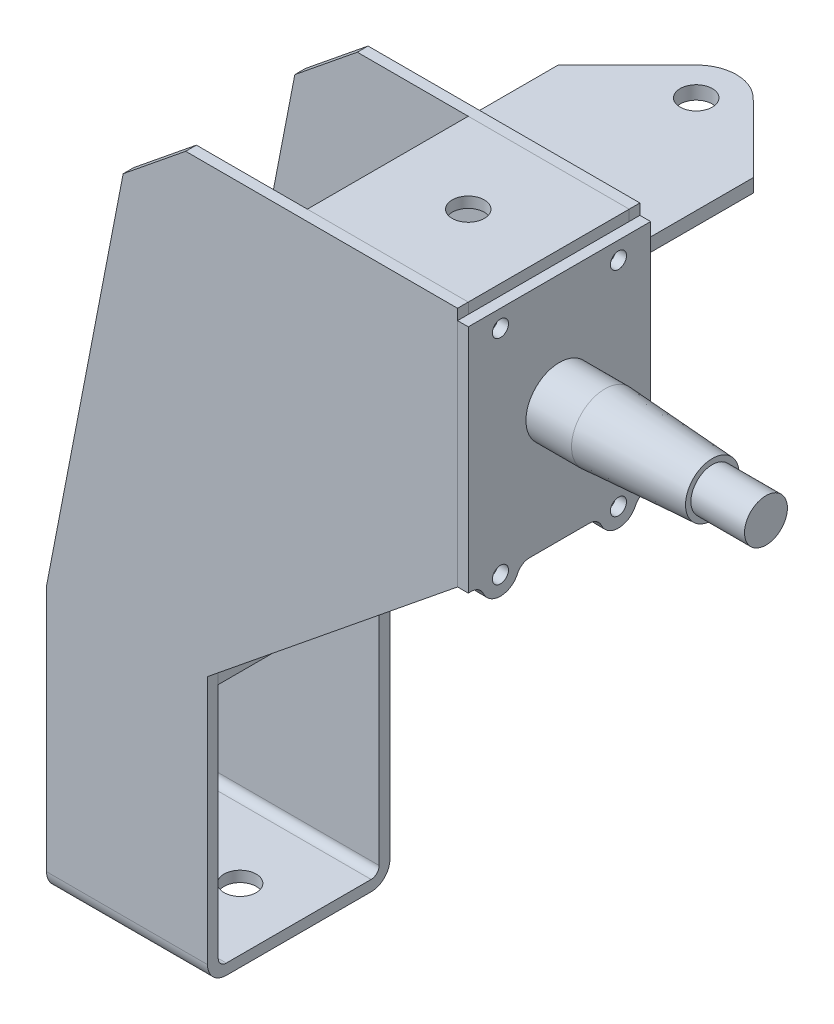
from build123d import *

# Parameters (mm, degrees)
BOSS_EXTRUDE2_DEPTH  = 107
CUT_EXTRUDE1_DEPTH   = 214
SKETCH5_W            = 60
SKETCH5_H            = 4
BOSS_EXTRUDE3_DEPTH  = 60
SKETCH6_W            = 60
SKETCH6_H            = 4
BOSS_EXTRUDE4_DEPTH  = 60
SKETCH7_R            = 3
BOSS_EXTRUDE5_DEPTH  = 4
SKETCH8_W            = 72.723840611
SKETCH8_H            = 5
BOSS_EXTRUDE6_DEPTH  = 100
CHAMFER1_SIZE        = 25
CHAMFER2_SIZE        = 25
SKETCH9_R            = 15
BOSS_EXTRUDE7_DEPTH  = 5
SKETCH10_R           = 12.25
CUT_EXTRUDE2_DEPTH   = 4
CUT_EXTRUDE5_DEPTH   = 8
SKETCH13_R           = 6
CUT_EXTRUDE6_DEPTH   = 10
SKETCH15_R           = 15
BOSS_EXTRUDE8_DEPTH  = 10
SKETCH16_R           = 12.25
BOSS_EXTRUDE9_DEPTH  = 10
SKETCH17_R           = 12.5
BOSS_EXTRUDE10_DEPTH = 77
SKETCH18_R           = 12.5
SKETCH18_R_2         = 8
CUT_EXTRUDE7_DEPTH   = 20
CHAMFER3_SIZE        = 40
CHAMFER3_SIZE2       = 2.5
SKETCH19_R           = 6
CUT_EXTRUDE8_DEPTH   = 20


with BuildPart() as part:
    # Sketch3 → Boss-Extrude2 (new, symmetric)
    with BuildSketch(Plane(origin=(0, 0, 0), x_dir=(0, 0, -1), z_dir=(1, 0, 0))):
        with BuildLine():
            Line((93.112387021, -93), (93.112387021, 165.555555556))
            Line((93.112387021, 165.555555556), (89.112387021, 165.555555556))
            Line((89.112387021, 165.555555556), (89.112387021, -93))
            ThreePointArc((89.112387021, -93), (88.233707365, -95.121320344), (86.112387021, -96))
            Line((86.112387021, -96), (32.112387021, -96))
            ThreePointArc((32.112387021, -96), (29.991066678, -95.121320344), (29.112387021, -93))
            Line((29.112387021, -93), (29.112387021, 165.555555556))
            Line((29.112387021, 165.555555556), (25.112387021, 165.555555556))
            Line((25.112387021, 165.555555556), (25.112387021, -93))
            ThreePointArc((25.112387021, -93), (27.162639553, -97.949747468), (32.112387021, -100))
            Line((32.112387021, -100), (86.112387021, -100))
            ThreePointArc((86.112387021, -100), (91.06213449, -97.949747468), (93.112387021, -93))
        make_face()
    extrude(amount=BOSS_EXTRUDE2_DEPTH, both=True)

    # Sketch4 → Cut-Extrude1 (cut)
    with BuildSketch(Plane.XY):
        Polygon((-190, 11.896699378), (-190, -230), (130, -230), (130, -61.975068301), (223.227453171, 13.580487255), (223.227453171, 295.555555556), (-54.204269584, 295.555555556), (-150.061773181, 217.868493514), align=None)
        Polygon((-60, -0.59060332), (-60, -100), (0, -100), (0, 0), (93.227453171, 75.555555556), (93.227453171, 165.555555556), (-8.139740481, 165.555555556), (-31.446603774, 146.666666667), align=None, mode=Mode.SUBTRACT)
    extrude(amount=-CUT_EXTRUDE1_DEPTH, mode=Mode.SUBTRACT)

    # Sketch13 → Cut-Extrude6 (cut)
    with BuildSketch(Plane.XZ.offset(100)):
        with Locations(Location((-23.160596036, -60.439663785, 0), (0, 0, 270))):
            Circle(SKETCH13_R)
    extrude(amount=-CUT_EXTRUDE6_DEPTH, mode=Mode.SUBTRACT)


with BuildPart() as body_2:
    # Sketch5 → Boss-Extrude3 (new body)
    with BuildSketch(Plane(origin=(0, 0, 0), x_dir=(0, 0, -1), z_dir=(1, 0, 0))):
        with Locations((59.112387021, -2.59060332)):
            Rectangle(SKETCH5_W, SKETCH5_H)
    extrude(amount=-BOSS_EXTRUDE3_DEPTH)


with BuildPart() as body_3:
    # Sketch6 → Boss-Extrude4 (new body)
    with BuildSketch(Plane(origin=(93.227453171, 0, 0), x_dir=(0, 0, -1), z_dir=(1, 0, 0))):
        with Locations((59.112387021, 163.555555556)):
            Rectangle(SKETCH6_W, SKETCH6_H)
    extrude(amount=-BOSS_EXTRUDE4_DEPTH)

    # Sketch12 → Cut-Extrude5 (cut)
    with BuildSketch(Plane(origin=(0, 165.555555556, 0), x_dir=(1, 0, 0), z_dir=(0, 1, 0))):
        with BuildLine():
            ThreePointArc((69.227453171, 59.112387021), (65.523553765, 64.655664216), (58.984812484, 63.355027708))
            Line((58.984812484, 63.355027708), (67.470093858, 54.869746334))
            ThreePointArc((67.470093858, 54.869746334), (68.770730366, 56.816286427), (69.227453171, 59.112387021))
        make_face()
        with BuildLine():
            Line((67.470093858, 54.869746334), (58.984812484, 63.355027708))
            ThreePointArc((58.984812484, 63.355027708), (58.984812484, 54.869746334), (67.470093858, 54.869746334))
        make_face()
    extrude(amount=-CUT_EXTRUDE5_DEPTH, mode=Mode.SUBTRACT)


with BuildPart() as body_4:
    # Sketch7 → Boss-Extrude5 (new body)
    with BuildSketch(Plane(origin=(93.227453171, 0, 0), x_dir=(0, 0, -1), z_dir=(1, 0, 0))):
        with BuildLine():
            Line((25.112387021, 161.555555556), (93.112387021, 161.555555556))
            Line((93.112387021, 161.555555556), (93.112387021, 75.555555556))
            Line((93.112387021, 75.555555556), (92.021099136, 75.555555556))
            ThreePointArc((92.021099136, 75.555555556), (89.320790512, 74.763682613), (87.475802422, 72.638888889))
            ThreePointArc((87.475802422, 72.638888889), (81.112387021, 68.555555556), (74.748971621, 72.638888889))
            ThreePointArc((74.748971621, 72.638888889), (72.903983531, 74.763682613), (70.203674907, 75.555555556))
            Line((70.203674907, 75.555555556), (48.021099136, 75.555555556))
            ThreePointArc((48.021099136, 75.555555556), (45.320790512, 74.763682613), (43.475802422, 72.638888889))
            ThreePointArc((43.475802422, 72.638888889), (37.112387021, 68.555555556), (30.748971621, 72.638888889))
            ThreePointArc((30.748971621, 72.638888889), (28.903983531, 74.763682613), (26.203674907, 75.555555556))
            Line((26.203674907, 75.555555556), (25.112387021, 75.555555556))
            Line((25.112387021, 75.555555556), (25.112387021, 161.555555556))
        make_face()
        with Locations((37.112387021, 155.082134103)):
            Circle(SKETCH7_R, mode=Mode.SUBTRACT)
        with Locations((81.112387021, 155.082134103)):
            Circle(SKETCH7_R, mode=Mode.SUBTRACT)
        with Locations((37.112387021, 75.555555556)):
            Circle(SKETCH7_R, mode=Mode.SUBTRACT)
        with Locations((81.112387021, 75.555555556)):
            Circle(SKETCH7_R, mode=Mode.SUBTRACT)
    extrude(amount=BOSS_EXTRUDE5_DEPTH)

    # Sketch10 → Cut-Extrude2 (cut)
    with BuildSketch(Plane(origin=(97.227453171, 0, 0), x_dir=(0, 0, -1), z_dir=(1, 0, 0))):
        with Locations((59.112387021, 120.555555556)):
            Circle(SKETCH10_R)
    extrude(amount=-CUT_EXTRUDE2_DEPTH, mode=Mode.SUBTRACT)


with BuildPart() as body_5:
    # Sketch8 → Boss-Extrude6 (new body)
    with BuildSketch(Plane(origin=(0, 0, -93.112387021), x_dir=(-1, 0, 0), z_dir=(0, 0, -1))):
        with Locations((-24.25985796, 117.5)):
            Rectangle(SKETCH8_W, SKETCH8_H)
    extrude(amount=BOSS_EXTRUDE6_DEPTH)

    # Chamfer1
    chamfer1_edges = [body_5.edges().sort_by_distance(p)[0] for p in [
        (-12.102062346, 117.5, -193.112387021),
    ]]
    chamfer(chamfer1_edges, length=CHAMFER1_SIZE)

    # Chamfer2
    chamfer2_edges = [body_5.edges().sort_by_distance(p)[0] for p in [
        (60.621778265, 117.5, -193.112387021),
    ]]
    chamfer(chamfer2_edges, length=CHAMFER2_SIZE)

    # Sketch9 → Boss-Extrude7 (add)
    with BuildSketch(Plane.XZ.offset(-115)):
        with Locations((24.221778265, -183.112387021)):
            Circle(SKETCH9_R)
    extrude(amount=-BOSS_EXTRUDE7_DEPTH)

    # Sketch19 → Cut-Extrude8 (cut)
    with BuildSketch(Plane.XZ.offset(-115)):
        with Locations((24.221778265, -183.112387021)):
            Circle(SKETCH19_R)
    extrude(amount=-CUT_EXTRUDE8_DEPTH, mode=Mode.SUBTRACT)


with BuildPart() as body_6:
    # Sketch15 → Boss-Extrude8 (new body)
    with BuildSketch(Plane.ZY.offset(-93.227453171)):
        with Locations((-59.112387021, 120.555555556)):
            Circle(SKETCH15_R)
    extrude(amount=BOSS_EXTRUDE8_DEPTH)


with BuildPart() as body_7:
    # Sketch16 → Boss-Extrude9 (new body)
    with BuildSketch(Plane(origin=(97.227453171, 0, 0), x_dir=(0, 0, -1), z_dir=(1, 0, 0))):
        with Locations((59.112387021, 120.555555556)):
            Circle(SKETCH16_R)
    extrude(amount=-BOSS_EXTRUDE9_DEPTH)


with BuildPart() as body_8:
    # Sketch17 → Boss-Extrude10 (new body)
    with BuildSketch(Plane(origin=(97.227453171, 0, 0), x_dir=(0, 0, -1), z_dir=(1, 0, 0))):
        with Locations((59.112387021, 120.555555556)):
            Circle(SKETCH17_R)
    extrude(amount=BOSS_EXTRUDE10_DEPTH)

    # Sketch18 → Cut-Extrude7 (cut)
    with BuildSketch(Plane(origin=(174.227453171, 0, 0), x_dir=(0, 0, -1), z_dir=(1, 0, 0))):
        with Locations((59.112387021, 120.555555556)):
            Circle(SKETCH18_R)
        with Locations((59.112387021, 120.555555556)):
            Circle(SKETCH18_R_2, mode=Mode.SUBTRACT)
    extrude(amount=-CUT_EXTRUDE7_DEPTH, mode=Mode.SUBTRACT)

    # Chamfer3
    chamfer3_edges = [body_8.edges().sort_by_distance(p)[0] for p in [
        (154.227453171, 120.555555556, -46.612387021),
    ]]
    chamfer3_side = [body_8.faces().sort_by_distance(p)[0] for p in [
        (125.727453171, 120.555555556, -46.612387021),
    ]]
    chamfer(chamfer3_edges, length=CHAMFER3_SIZE, length2=CHAMFER3_SIZE2, reference=chamfer3_side[0])

    # Combine1: union body 7, body 6
    add(body_7.part)
    add(body_6.part)


solid = Compound([part.part, body_2.part, body_3.part, body_4.part, body_5.part, body_8.part])
